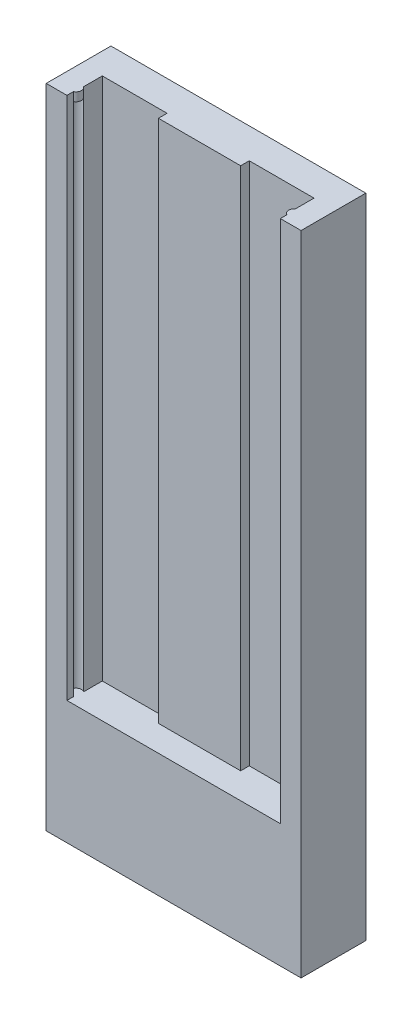
from build123d import *

# Parameters (mm, degrees)
BOSS_EXTRUDE1_DEPTH = 381
SKETCH4_R           = 3.175
BOSS_EXTRUDE2_DEPTH = 5.08
BOSS_EXTRUDE3_START = -5.08
SKETCH5_R           = 3.175
BOSS_EXTRUDE3_DEPTH = 5.08
SCALE1_SCALE        = 0.7
SKETCH8_W           = 105
SKETCH8_H           = 26.67
BOSS_EXTRUDE6_DEPTH = 50.8


with BuildPart() as part:
    # Sketch3 → Boss-Extrude1 (new body)
    with BuildSketch(Plane(origin=(0, 0, 0), x_dir=(1, 0, 0), z_dir=(0, 1, 0))):
        with BuildLine():
            Line((0, 0), (0, 38.1))
            Line((0, 38.1), (150, 38.1))
            Line((150, 38.1), (150, 0))
            Line((150, 0), (137.808, 0))
            Line((137.808, 0), (137.808, 3.81))
            ThreePointArc((137.808, 3.81), (142.319844489, 6.978228189), (137.3, 9.257607897))
            Line((137.3, 9.257607897), (137.3, 20.32))
            Line((137.3, 20.32), (99.2, 20.32))
            Line((99.2, 20.32), (99.2, 15.24))
            Line((99.2, 15.24), (50.8, 15.24))
            Line((50.8, 15.24), (50.8, 20.32))
            Line((50.8, 20.32), (12.7, 20.32))
            Line((12.7, 20.32), (12.7, 9.257607897))
            ThreePointArc((12.7, 9.257607897), (7.680155511, 6.978228189), (12.192, 3.81))
            Line((12.192, 3.81), (12.192, 0))
            Line((12.192, 0), (0, 0))
        make_face()
    extrude(amount=BOSS_EXTRUDE1_DEPTH)

    # Sketch4 → Boss-Extrude2 (add)
    with BuildSketch(Plane(origin=(0, 0, 0), x_dir=(1, 0, 0), z_dir=(0, 1, 0))):
        with Locations((10.841440118, 6.683432269)):
            Circle(SKETCH4_R)
        with Locations((139.158559882, 6.683432269)):
            Circle(SKETCH4_R)
    extrude(amount=BOSS_EXTRUDE2_DEPTH)

    # Sketch5 → Boss-Extrude3 (add)
    with BuildSketch(Plane(origin=(0, 381, 0), x_dir=(1, 0, 0), z_dir=(0, 1, 0)).offset(BOSS_EXTRUDE3_START)):
        with Locations((139.158559882, 6.683432269)):
            Circle(SKETCH5_R)
        with Locations((10.841440118, 6.683432269)):
            Circle(SKETCH5_R)
    extrude(amount=BOSS_EXTRUDE3_DEPTH)


with BuildPart() as part_1:
    # Scale1: scaled about (75, 190.5, -25.842389862)
    add(part.part.scale(SCALE1_SCALE).moved(Location((22.5, 57.15, -7.752716959))))

    # Sketch8 → Boss-Extrude6 (add)
    with BuildSketch(Plane.XZ.offset(-57.15)):
        with Locations((75, -21.087716959)):
            Rectangle(SKETCH8_W, SKETCH8_H)
    extrude(amount=-BOSS_EXTRUDE6_DEPTH)


solid = part_1.part
